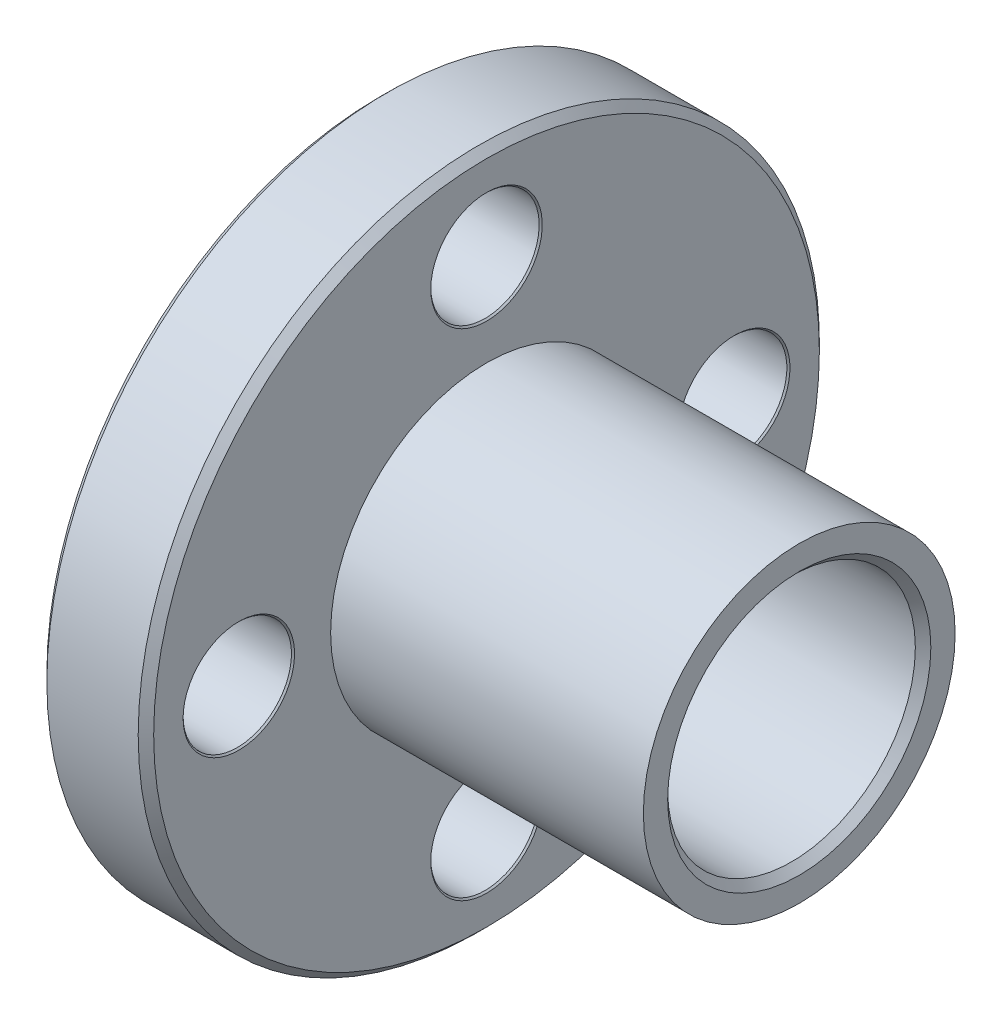
from build123d import *

# Parameters (mm, degrees)
F_3_5_3_5_DIAMETER_HOLE1_AT_2_COUNT = 2
F_3_5_3_5_DIAMETER_HOLE1_AT_2_PITCH = 11.313708499
F_3_5_3_5_DIAMETER_HOLE1_AT_3_COUNT = 2
F_3_5_3_5_DIAMETER_HOLE1_AT_3_PITCH = 16
F_3_5_3_5_DIAMETER_HOLE1_AT_4_COUNT = 2
F_3_5_3_5_DIAMETER_HOLE1_AT_4_PITCH = 11.313708499
CHAMFER1_SIZE                       = 0.25


with BuildPart() as part:
    # Sketch1 → Revolve1 (revolve)
    with BuildSketch(Plane.XY, mode=Mode.PRIVATE) as revolve1_sk:
        Polygon((7.525, 0), (7.525, 5.035), (-2.575, 5.035), (-2.575, 11), (-6.025, 11), (-6.025, 5.035), (-7.525, 5.035), (-7.525, 0), align=None)
    revolve(revolve1_sk.sketch.rotate(Axis((-7.525, 0, 0), (1, 0, 0)), 90), axis=Axis((-7.525, 0, 0), (1, 0, 0)))

    # Sketch3 → Ø8.0 (8) Diameter Hole1 (revolve, cut)
    with BuildSketch(Plane(origin=(-7.525, 0, 0), x_dir=(0, 0, 1), z_dir=(0, 1, 0))):
        Polygon((0, 0), (0, 15.05), (4.25, 15.05), (4, 14.8), (4, 0.25), (4.25, 0), align=None)
    revolve(axis=Axis((-13.875, 0, 0), (1, 0, 0)), mode=Mode.SUBTRACT)

    # Sketch7 → Ø3.5 (3.5) Diameter Hole1 (revolve, cut)
    with BuildSketch(Plane(origin=(-6.025, 8, 0), x_dir=(0, 0, 1), z_dir=(0, 1, 0))):
        Polygon((0, 0), (0, 3.45), (1.8, 3.45), (1.75, 3.4), (1.75, 0.05), (1.8, 0), align=None)
    f_3_5_3_5_diameter_hole1 = revolve(axis=Axis((-12.375, 8, 0), (1, 0, 0)), mode=Mode.SUBTRACT)

    # Ø3.5 (3.5) Diameter Hole1 at 2: Ø3.5 (3.5) Diameter Hole1 ×2
    with Locations(*[Vector(0, -0.7071067811865476, 0.7071067811865476) * (i * F_3_5_3_5_DIAMETER_HOLE1_AT_2_PITCH) for i in range(1, F_3_5_3_5_DIAMETER_HOLE1_AT_2_COUNT)]):
        add(f_3_5_3_5_diameter_hole1, mode=Mode.SUBTRACT)

    # Ø3.5 (3.5) Diameter Hole1 at 3: Ø3.5 (3.5) Diameter Hole1 ×2
    with Locations(*[(0, -i * F_3_5_3_5_DIAMETER_HOLE1_AT_3_PITCH, 0) for i in range(1, F_3_5_3_5_DIAMETER_HOLE1_AT_3_COUNT)]):
        add(f_3_5_3_5_diameter_hole1, mode=Mode.SUBTRACT)

    # Ø3.5 (3.5) Diameter Hole1 at 4: Ø3.5 (3.5) Diameter Hole1 ×2
    with Locations(*[Vector(0, -0.7071067811865476, -0.7071067811865476) * (i * F_3_5_3_5_DIAMETER_HOLE1_AT_4_PITCH) for i in range(1, F_3_5_3_5_DIAMETER_HOLE1_AT_4_COUNT)]):
        add(f_3_5_3_5_diameter_hole1, mode=Mode.SUBTRACT)

    # Chamfer1
    chamfer1_edges = [part.edges().sort_by_distance(p)[0] for p in [
        (-6.025, 0, -11),
        (-2.575, 0, -11),
    ]]
    chamfer(chamfer1_edges, length=CHAMFER1_SIZE)


solid = part.part
